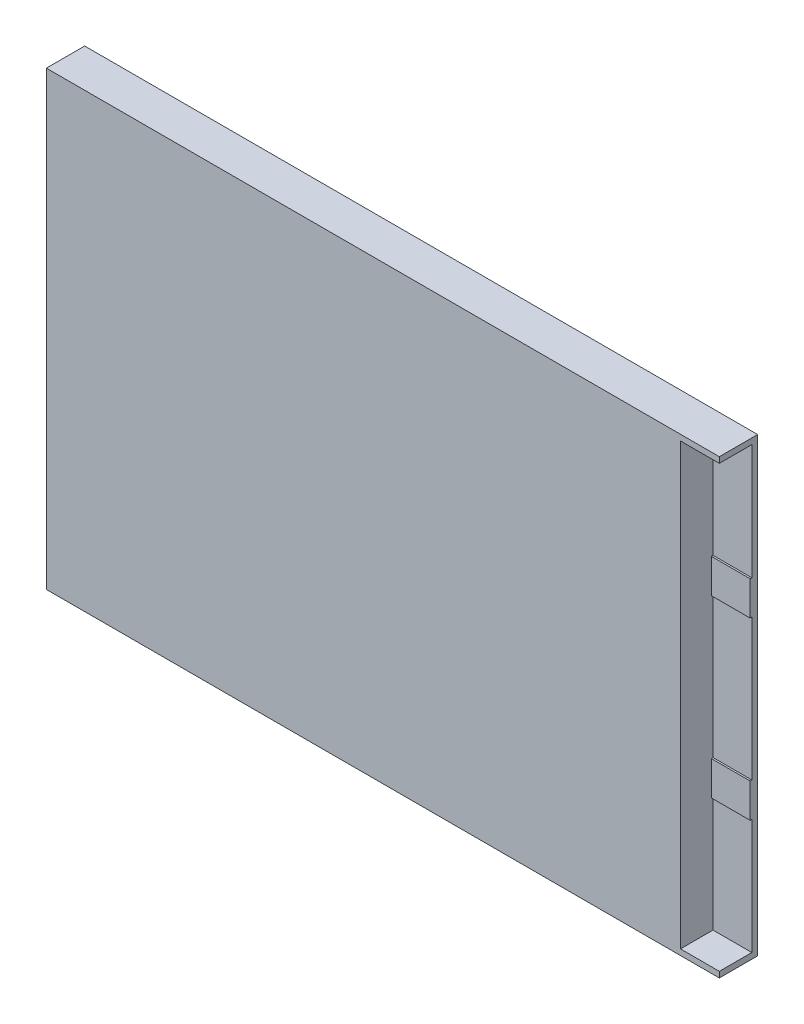
from build123d import *

# Parameters (mm, degrees)
SKETCH1_W           = 100.33
SKETCH1_H           = 67.31
BOSS_EXTRUDE1_DEPTH = 2.8575
SKETCH2_W           = 5.7912
SKETCH2_H           = 65.5828
CUT_EXTRUDE1_DEPTH  = 4.8514
SKETCH3_W           = 5.7912
SKETCH3_H           = 5.08
BOSS_EXTRUDE2_DEPTH = 0.254


with BuildPart() as part:
    # Sketch1 → Boss-Extrude1 (new, symmetric)
    with BuildSketch(Plane.XY):
        Rectangle(SKETCH1_W, SKETCH1_H)
    extrude(amount=BOSS_EXTRUDE1_DEPTH, both=True)

    # Sketch2 → Cut-Extrude1 (cut)
    with BuildSketch(Plane.XY.offset(2.8575)):
        with Locations((47.2694, 0)):
            Rectangle(SKETCH2_W, SKETCH2_H)
    extrude(amount=-CUT_EXTRUDE1_DEPTH, mode=Mode.SUBTRACT)

    # Sketch3 → Boss-Extrude2 (add)
    with BuildSketch(Plane.XY.offset(-1.9939)):
        with Locations((47.2694, -13.0556)):
            Rectangle(SKETCH3_W, SKETCH3_H)
        with Locations((47.2694, 13.0556)):
            Rectangle(SKETCH3_W, SKETCH3_H)
    extrude(amount=BOSS_EXTRUDE2_DEPTH)


solid = part.part
